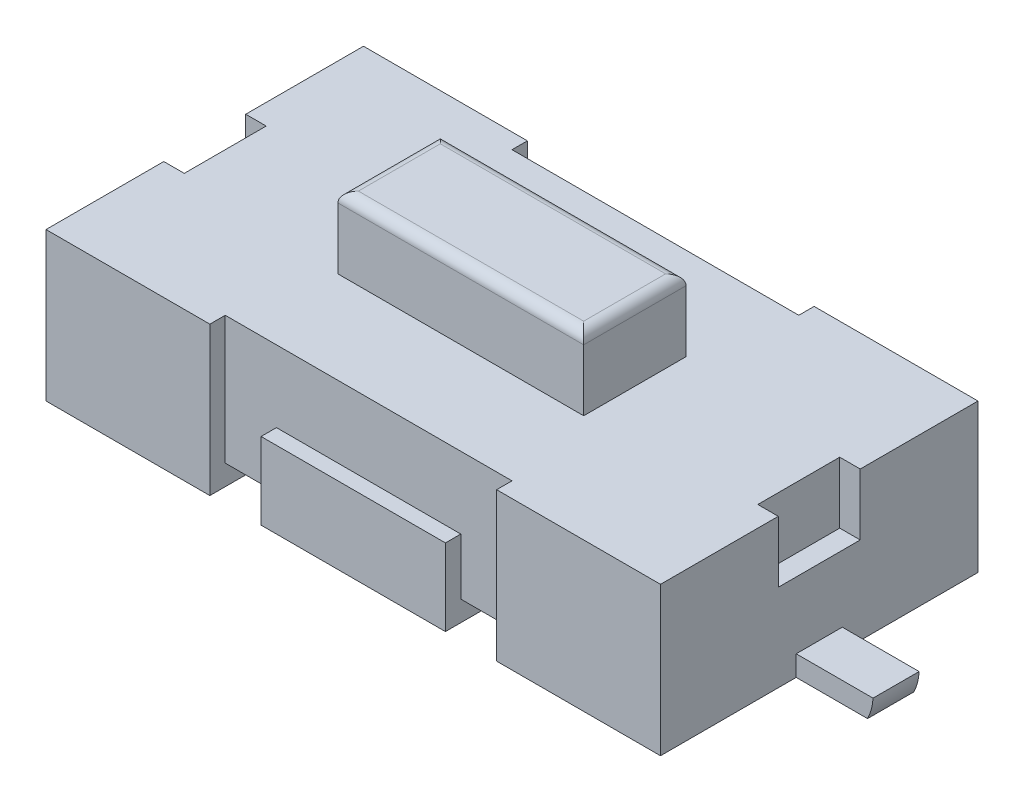
from build123d import *

# Parameters (mm, degrees)
SKETCH1_W           = 6
SKETCH1_H           = 3.1
BOSS_EXTRUDE1_DEPTH = 1.45
SKETCH2_W           = 2.4
SKETCH2_H           = 1
BOSS_EXTRUDE2_DEPTH = 0.7
FILLET1_R           = 0.1
SKETCH3_W           = 0.8
SKETCH3_H           = 0.6
CUT_EXTRUDE1_DEPTH  = 0.2
SKETCH4_W           = 0.8
SKETCH4_H           = 0.6
CUT_EXTRUDE2_DEPTH  = 0.2
CUT_EXTRUDE3_DEPTH  = 0.15
CUT_EXTRUDE4_DEPTH  = 0.15
SKETCH7_W           = 0.5
SKETCH7_H           = 0.5
CUT_EXTRUDE5_DEPTH  = 0.2
BOSS_EXTRUDE4_DEPTH = 0.225
SKETCH9_W           = 5.2
SKETCH9_H           = 2.1
BOSS_EXTRUDE5_DEPTH = 0.025


with BuildPart() as part:
    # Sketch1 → Boss-Extrude1 (new body)
    with BuildSketch(Plane(origin=(0, 0, 0), x_dir=(1, 0, 0), z_dir=(0, 1, 0))):
        Rectangle(SKETCH1_W, SKETCH1_H)
    extrude(amount=BOSS_EXTRUDE1_DEPTH)

    # Sketch3 → Cut-Extrude1 (cut)
    with BuildSketch(Plane.ZY.offset(3)):
        with Locations((0, 1.15)):
            Rectangle(SKETCH3_W, SKETCH3_H)
    extrude(amount=-CUT_EXTRUDE1_DEPTH, mode=Mode.SUBTRACT)

    # Sketch4 → Cut-Extrude2 (cut)
    with BuildSketch(Plane(origin=(3, 0, 0), x_dir=(0, 0, -1), z_dir=(1, 0, 0))):
        with Locations((0, 1.15)):
            Rectangle(SKETCH4_W, SKETCH4_H)
    extrude(amount=-CUT_EXTRUDE2_DEPTH, mode=Mode.SUBTRACT)

    # Sketch5 → Cut-Extrude3 (cut)
    with BuildSketch(Plane.XY.offset(1.55)):
        Polygon((-1.4, 1.45), (1.4, 1.45), (1.4, 0), (0.9, 0), (0.9, 0.75), (-0.9, 0.75), (-0.9, 0), (-1.4, 0), align=None)
    extrude(amount=-CUT_EXTRUDE3_DEPTH, mode=Mode.SUBTRACT)

    # Sketch6 → Cut-Extrude4 (cut)
    with BuildSketch(Plane(origin=(0, 0, -1.55), x_dir=(-1, 0, 0), z_dir=(0, 0, -1))):
        Polygon((-1.4, 1.45), (1.4, 1.45), (1.4, 0), (0.9, 0), (0.9, 0.75), (-0.9, 0.75), (-0.9, 0), (-1.4, 0), align=None)
    extrude(amount=-CUT_EXTRUDE4_DEPTH, mode=Mode.SUBTRACT)

    # Sketch7 → Cut-Extrude5 (cut)
    with BuildSketch(Plane.XZ):
        with Locations((-1.15, 1.15)):
            Rectangle(SKETCH7_W, SKETCH7_H)
        with Locations((1.15, 1.15)):
            Rectangle(SKETCH7_W, SKETCH7_H)
        with Locations((1.15, -1.15)):
            Rectangle(SKETCH7_W, SKETCH7_H)
        with Locations((-1.15, -1.15)):
            Rectangle(SKETCH7_W, SKETCH7_H)
    extrude(amount=-CUT_EXTRUDE5_DEPTH, mode=Mode.SUBTRACT)



with BuildPart() as body_2:
    # Sketch2 → Boss-Extrude2 (new body)
    with BuildSketch(Plane(origin=(0, 1.45, 0), x_dir=(1, 0, 0), z_dir=(0, 1, 0))):
        Rectangle(SKETCH2_W, SKETCH2_H)
    extrude(amount=BOSS_EXTRUDE2_DEPTH)

    # Fillet1
    fillet1_edges = [body_2.edges().sort_by_distance(p)[0] for p in [
        (-1.2, 2.15, 0),
        (0, 2.15, 0.5),
        (1.2, 2.15, 0),
        (0, 2.15, -0.5),
    ]]
    fillet(fillet1_edges, radius=FILLET1_R)


with BuildPart() as body_3:
    # Sketch8 → Boss-Extrude4 (new, symmetric)
    with BuildSketch(Plane.XY):
        with BuildLine():
            Line((-3.69668524, 0), (3.69668524, 0))
            ThreePointArc((3.69668524, 0), (3.733805117, 0.097210972), (3.75, 0.2))
            Line((3.75, 0.2), (-3.75, 0.2))
            ThreePointArc((-3.75, 0.2), (-3.733805117, 0.097210972), (-3.69668524, 0))
        make_face()
    extrude(amount=BOSS_EXTRUDE4_DEPTH, both=True)


with BuildPart() as part_1:
    add(part.part)

    add(body_3.part)  # Boss-Extrude5 merges body 3
    # Sketch9 → Boss-Extrude5 (add)
    with BuildSketch(Plane(origin=(0, 0, 0), x_dir=(1, 0, 0), z_dir=(0, 1, 0))):
        Rectangle(SKETCH9_W, SKETCH9_H)
    extrude(amount=BOSS_EXTRUDE5_DEPTH)


solid = Compound([body_2.part, part_1.part])
